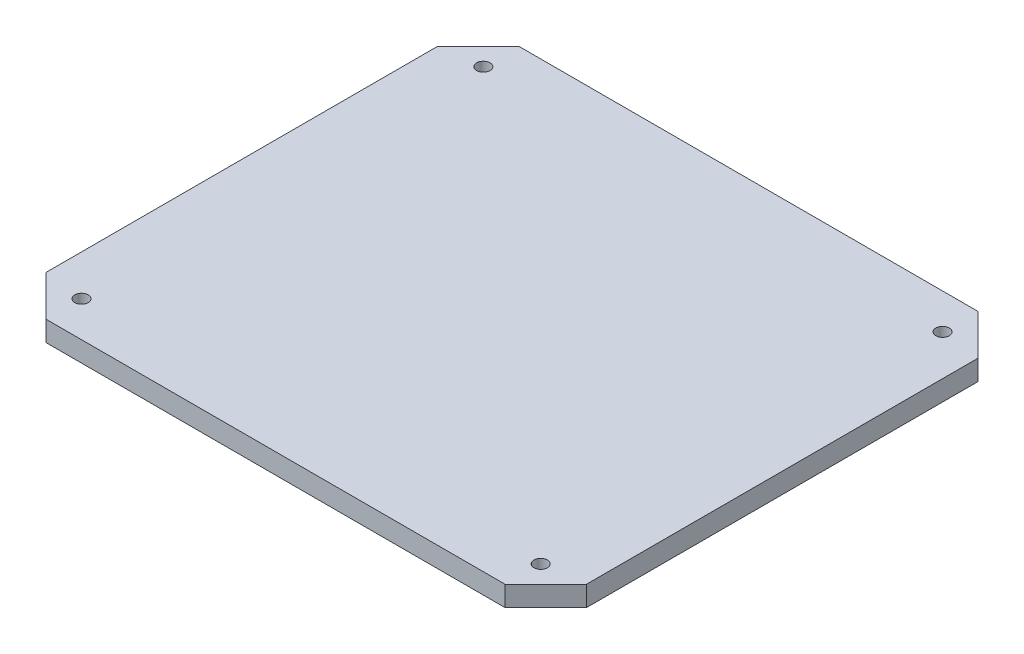
from build123d import *

# Parameters (mm, degrees)
SKETCH1_W           = 400
SKETCH1_H           = 350
SKETCH1_R           = 5
BOSS_EXTRUDE1_DEPTH = 15
CUT_EXTRUDE1_DEPTH  = 267.176633084


with BuildPart() as part:
    # Sketch1 → Boss-Extrude1 (new body)
    with BuildSketch(Plane(origin=(0, 0, 0), x_dir=(1, 0, 0), z_dir=(0, 1, 0))):
        Rectangle(SKETCH1_W, SKETCH1_H)
        with Locations(Location((-170, 148.75, 0), (0, 0, 270))):
            Circle(SKETCH1_R, mode=Mode.SUBTRACT)
        with Locations(Location((170, 148.75, 0), (0, 0, 90))):
            Circle(SKETCH1_R, mode=Mode.SUBTRACT)
        with Locations(Location((170, -148.75, 0), (0, 0, 270))):
            Circle(SKETCH1_R, mode=Mode.SUBTRACT)
        with Locations(Location((-170, -148.75, 0), (0, 0, 90))):
            Circle(SKETCH1_R, mode=Mode.SUBTRACT)
    extrude(amount=BOSS_EXTRUDE1_DEPTH)

    # Sketch2 → Cut-Extrude1 (cut, through all)
    with BuildSketch(Plane(origin=(0, 15, 0), x_dir=(1, 0, 0), z_dir=(0, 1, 0))):
        Polygon((-170, 175), (-200, 145), (-200, 175), align=None)
        Polygon((170, 175), (200, 145), (200, 175), align=None)
        Polygon((200, -175), (170, -175), (200, -145), align=None)
        Polygon((-170, -175), (-200, -145), (-200, -175), align=None)
    extrude(amount=-CUT_EXTRUDE1_DEPTH, mode=Mode.SUBTRACT)


solid = part.part
